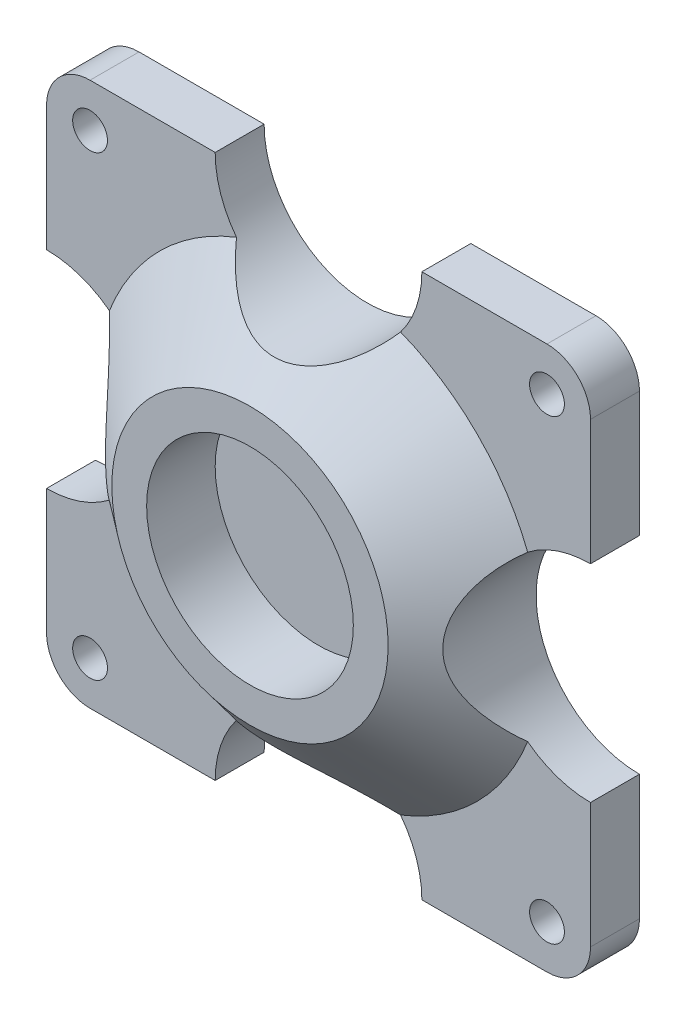
from build123d import *

# Parameters (mm, degrees)
BOSS_EXTRUDE1_DEPTH     = 9
SKETCH2_R               = 41.3
SKETCH3_R               = 25.4
SKETCH4_R               = 19
CUT_EXTRUDE1_DEPTH      = 12.6
SKETCH5_R               = 3.2
CUT_EXTRUDE2_DEPTH      = 9
CUT_EXTRUDE3_DEPTH      = 72.824508369
CUT_EXTRUDE3_DEPTH_BACK = 72.824508369
CUT_EXTRUDE4_DEPTH      = 72.824508439


with BuildPart() as part:
    # Sketch1 → Boss-Extrude1 (new body)
    with BuildSketch(Plane.XY):
        with BuildLine():
            Line((-42, 50), (42, 50))
            ThreePointArc((42, 50), (47.656854249, 47.656854249), (50, 42))
            Line((50, 42), (50, -42))
            ThreePointArc((50, -42), (47.656854249, -47.656854249), (42, -50))
            Line((42, -50), (-42, -50))
            ThreePointArc((-42, -50), (-47.656854249, -47.656854249), (-50, -42))
            Line((-50, -42), (-50, 42))
            ThreePointArc((-50, 42), (-47.656854249, 47.656854249), (-42, 50))
        make_face()
    extrude(amount=BOSS_EXTRUDE1_DEPTH)

    # Sketch2 → Loft1 section 0
    with BuildSketch(Plane.XY.offset(9)):
        Circle(SKETCH2_R)
    # Sketch3 → Loft1 section 1
    with BuildSketch(Plane.XY.offset(21.6)):
        Circle(SKETCH3_R)
    loft()

    # Sketch4 → Cut-Extrude1 (cut)
    with BuildSketch(Plane.XY.offset(21.6)):
        Circle(SKETCH4_R)
    extrude(amount=-CUT_EXTRUDE1_DEPTH, mode=Mode.SUBTRACT)

    # Sketch5 → Cut-Extrude2 (cut)
    with BuildSketch(Plane.XY.offset(9)):
        with Locations((-42, 42)):
            Circle(SKETCH5_R)
        with Locations((42, 42)):
            Circle(SKETCH5_R)
    cut_extrude2 = extrude(amount=-CUT_EXTRUDE2_DEPTH, mode=Mode.SUBTRACT)

    # Mirror1: Cut-Extrude2 across plane
    add(cut_extrude2.mirror(Plane.ZX), mode=Mode.SUBTRACT)

    # Sketch6 → Cut-Extrude3 (cut, two sides: drawn at the far end of the back side and taken through both)
    with BuildSketch(Plane.XY.offset(9).offset(-CUT_EXTRUDE3_DEPTH_BACK)):
        with BuildLine():
            Line((-19, -50), (19, -50))
            ThreePointArc((19, -50), (0, -31), (-19, -50))
        make_face()
        with BuildLine():
            Line((-19, 50), (19, 50))
            ThreePointArc((19, 50), (0, 31), (-19, 50))
        make_face()
    extrude(amount=CUT_EXTRUDE3_DEPTH + CUT_EXTRUDE3_DEPTH_BACK, mode=Mode.SUBTRACT)

    # Sketch8 → Cut-Extrude4 (cut, symmetric)
    with BuildSketch(Plane.XY.offset(9)):
        with BuildLine():
            Line((50, 19), (50, -19))
            ThreePointArc((50, -19), (31, 0), (50, 19))
        make_face()
    cut_extrude4 = extrude(amount=CUT_EXTRUDE4_DEPTH, both=True, mode=Mode.SUBTRACT)

    # Mirror3: Cut-Extrude4 across plane
    add(cut_extrude4.mirror(Plane(origin=(0, 0, 0), x_dir=(0, 0, 1), z_dir=(1, 0, 0))), mode=Mode.SUBTRACT)


solid = part.part
